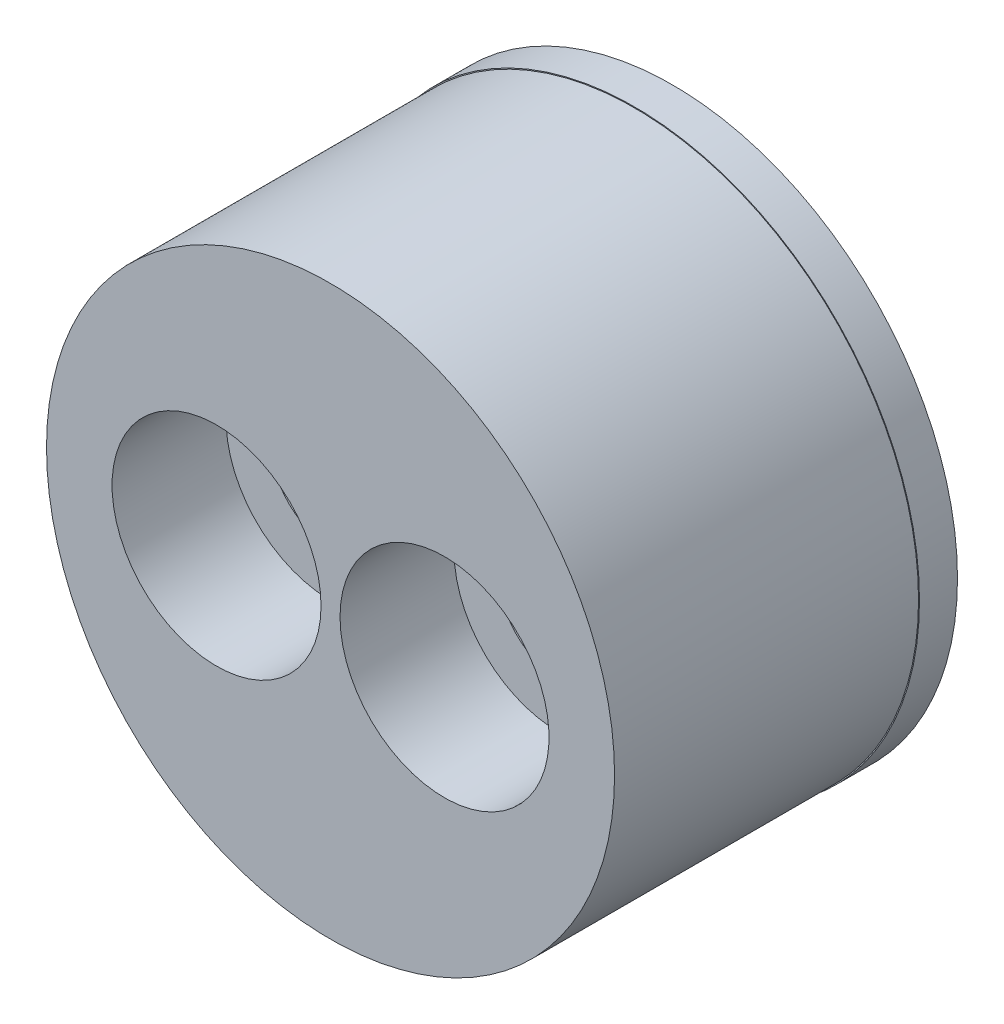
from build123d import *

# Parameters (mm, degrees)
SKETCH1_R           = 7.5
BOSS_EXTRUDE1_DEPTH = 1
SKETCH2_R           = 7.475
BOSS_EXTRUDE2_DEPTH = 8
SKETCH3_R           = 1.55
CUT_EXTRUDE1_DEPTH  = 14.910427743
SKETCH4_R           = 2.75
CUT_EXTRUDE2_DEPTH  = 3


with BuildPart() as part:
    # Sketch1 → Boss-Extrude1 (new body)
    with BuildSketch(Plane.XY):
        Circle(SKETCH1_R)
    extrude(amount=BOSS_EXTRUDE1_DEPTH)

    # Sketch2 → Boss-Extrude2 (add)
    with BuildSketch(Plane.XY.offset(1)):
        Circle(SKETCH2_R)
    extrude(amount=BOSS_EXTRUDE2_DEPTH)

    # Sketch3 → Cut-Extrude1 (cut, through all)
    with BuildSketch(Plane.XY.offset(9)):
        with Locations((-3, 0)):
            Circle(SKETCH3_R)
        with Locations(Location((3, 0, 0), (0, 0, 180))):
            Circle(SKETCH3_R)
    extrude(amount=-CUT_EXTRUDE1_DEPTH, mode=Mode.SUBTRACT)

    # Sketch4 → Cut-Extrude2 (cut)
    with BuildSketch(Plane.XY.offset(9)):
        with Locations((-3, 0)):
            Circle(SKETCH4_R)
        with Locations(Location((3, 0, 0), (0, 0, 180))):
            Circle(SKETCH4_R)
    extrude(amount=-CUT_EXTRUDE2_DEPTH, mode=Mode.SUBTRACT)


solid = part.part
